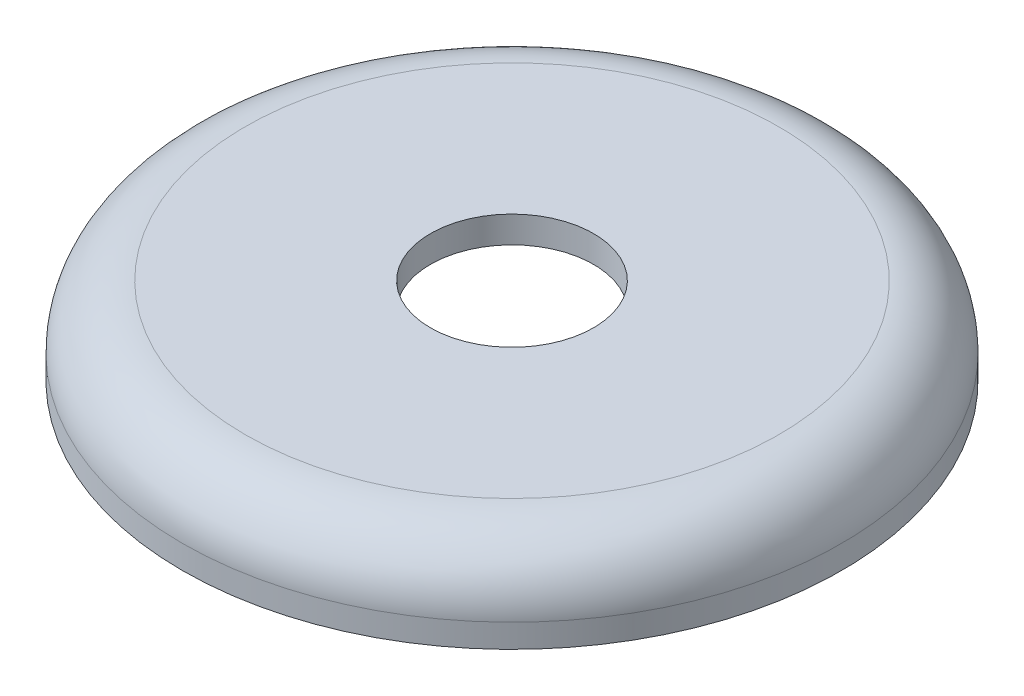
from build123d import *

# Parameters (mm, degrees)
SKETCH1_R           = 21
BOSS_EXTRUDE1_DEPTH = 5.5
FILLET2_R           = 4
SHELL3_T            = -1.7
SKETCH3_R           = 5.2
CUT_EXTRUDE2_DEPTH  = 31.203476621


with BuildPart() as part:
    # Sketch1 → Boss-Extrude1 (new body)
    with BuildSketch(Plane(origin=(0, 0, 0), x_dir=(1, 0, 0), z_dir=(0, 1, 0))):
        with Locations(Location((0, 0, 0), (0, 0, 270))):
            Circle(SKETCH1_R)
    extrude(amount=BOSS_EXTRUDE1_DEPTH)

    # Fillet2
    fillet2_edges = [part.edges().sort_by_distance(p)[0] for p in [
        (0, 5.5, -21),
    ]]
    fillet(fillet2_edges, radius=FILLET2_R)

    # Shell3
    shell3_openings = [part.faces().sort_by_distance(p)[0] for p in [
        (0, 0, 0),
    ]]
    offset(amount=SHELL3_T, openings=shell3_openings, kind=Kind.INTERSECTION)

    # Sketch3 → Cut-Extrude2 (cut, through all)
    with BuildSketch(Plane(origin=(0, 5.5, 0), x_dir=(1, 0, 0), z_dir=(0, 1, 0))):
        with Locations(Location((0, 0, 0), (0, 0, 270))):
            Circle(SKETCH3_R)
    extrude(amount=-CUT_EXTRUDE2_DEPTH, mode=Mode.SUBTRACT)


solid = part.part
